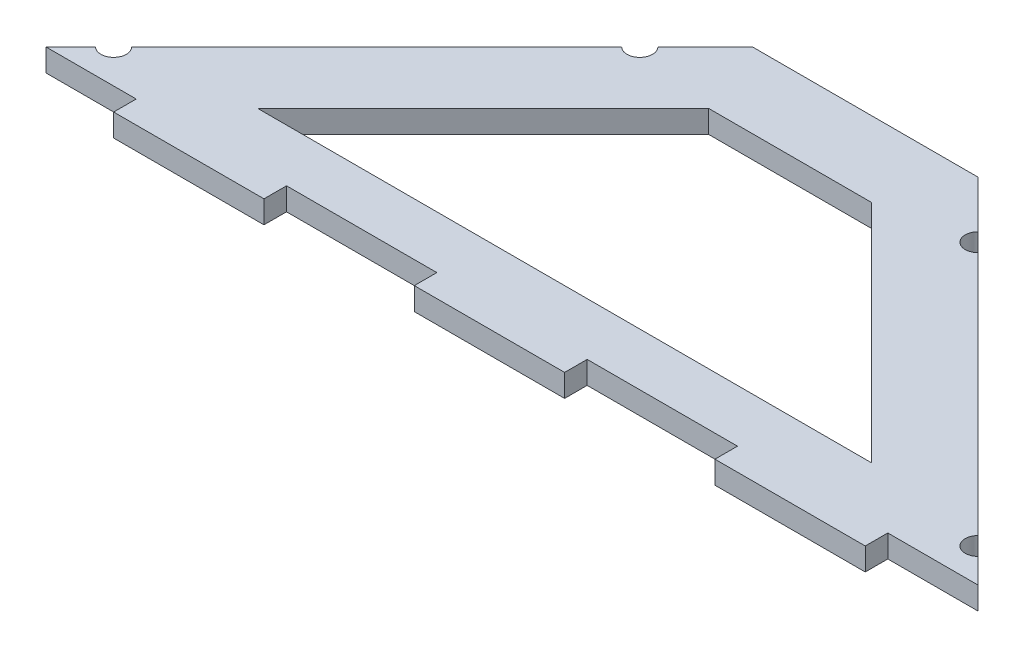
from build123d import *

# Parameters (mm, degrees)
SKETCH1_W           = 130
SKETCH1_H           = 130
SKETCH1_W_2         = 30
SKETCH1_H_2         = 30
BOSS_EXTRUDE1_DEPTH = 3
CUT_EXTRUDE1_DEPTH  = 3
CUT_EXTRUDE2_DEPTH  = 3
CUT_EXTRUDE3_DEPTH  = 10
SKETCH6_W           = 20
SKETCH6_H           = 3
CUT_EXTRUDE4_DEPTH  = 10


with BuildPart() as part:
    # Sketch1 → Boss-Extrude1 (new body)
    with BuildSketch(Plane(origin=(0, 0, 0), x_dir=(1, 0, 0), z_dir=(0, 1, 0))):
        Rectangle(SKETCH1_W, SKETCH1_H)
        Polygon((-55, 40.857864376), (-25, 10.857864376), (-25, -10.857864376), (-55, -40.857864376), align=None, mode=Mode.SUBTRACT)
        Polygon((-40.857864376, -55), (-10.857864376, -25), (10.857864376, -25), (40.857864376, -55), align=None, mode=Mode.SUBTRACT)
        Polygon((55, -40.857864376), (25, -10.857864376), (25, 10.857864376), (55, 40.857864376), align=None, mode=Mode.SUBTRACT)
        Polygon((40.857864376, 55), (10.857864376, 25), (-10.857864376, 25), (-40.857864376, 55), align=None, mode=Mode.SUBTRACT)
        Rectangle(SKETCH1_W_2, SKETCH1_H_2, mode=Mode.SUBTRACT)
    extrude(amount=BOSS_EXTRUDE1_DEPTH)

    # Sketch2 → Cut-Extrude1 (cut)
    with BuildSketch(Plane(origin=(0, 3, 0), x_dir=(1, 0, 0), z_dir=(0, 1, 0))):
        with BuildLine():
            ThreePointArc((-55.8, 57.5), (-58.702081528, 58.702081528), (-57.5, 55.8))
            Line((-57.5, 55.8), (-57.5, 57.5))
            Line((-57.5, 57.5), (-55.8, 57.5))
        make_face()
        with BuildLine():
            Line((-57.5, 57.5), (-57.5, 55.8))
            ThreePointArc((-57.5, 55.8), (-56.297918472, 56.297918472), (-55.8, 57.5))
            Line((-55.8, 57.5), (-57.5, 57.5))
        make_face()
        with BuildLine():
            Line((-57.5, -55.8), (-57.5, -57.5))
            Line((-57.5, -57.5), (-55.8, -57.5))
            ThreePointArc((-55.8, -57.5), (-56.297918472, -56.297918472), (-57.5, -55.8))
        make_face()
        with BuildLine():
            Line((-55.8, -57.5), (-57.5, -57.5))
            Line((-57.5, -57.5), (-57.5, -55.8))
            ThreePointArc((-57.5, -55.8), (-58.702081528, -58.702081528), (-55.8, -57.5))
        make_face()
        with BuildLine():
            ThreePointArc((57.5, -55.8), (56.297918472, -56.297918472), (55.8, -57.5))
            Line((55.8, -57.5), (57.5, -57.5))
            Line((57.5, -57.5), (57.5, -55.8))
        make_face()
        with BuildLine():
            Line((57.5, -57.5), (55.8, -57.5))
            ThreePointArc((55.8, -57.5), (57.5, -59.2), (59.2, -57.5))
            ThreePointArc((59.2, -57.5), (58.702081528, -56.297918472), (57.5, -55.8))
            Line((57.5, -55.8), (57.5, -57.5))
        make_face()
        with BuildLine():
            ThreePointArc((55.8, 57.5), (56.297918472, 56.297918472), (57.5, 55.8))
            Line((57.5, 55.8), (57.5, 57.5))
            Line((57.5, 57.5), (55.8, 57.5))
        make_face()
        with BuildLine():
            Line((57.5, 57.5), (57.5, 55.8))
            ThreePointArc((57.5, 55.8), (58.702081528, 56.297918472), (59.2, 57.5))
            ThreePointArc((59.2, 57.5), (57.5, 59.2), (55.8, 57.5))
            Line((55.8, 57.5), (57.5, 57.5))
        make_face()
    extrude(amount=-CUT_EXTRUDE1_DEPTH, mode=Mode.SUBTRACT)

    # Sketch3 → Cut-Extrude2 (cut)
    with BuildSketch(Plane(origin=(0, 3, 0), x_dir=(1, 0, 0), z_dir=(0, 1, 0))):
        with BuildLine():
            Line((-22.5, -20.8), (-22.5, -22.5))
            Line((-22.5, -22.5), (-20.8, -22.5))
            ThreePointArc((-20.8, -22.5), (-21.297918472, -21.297918472), (-22.5, -20.8))
        make_face()
        with BuildLine():
            Line((-20.8, -22.5), (-22.5, -22.5))
            Line((-22.5, -22.5), (-22.5, -20.8))
            ThreePointArc((-22.5, -20.8), (-23.702081528, -23.702081528), (-20.8, -22.5))
        make_face()
        with BuildLine():
            ThreePointArc((-20.8, 22.5), (-23.702081528, 23.702081528), (-22.5, 20.8))
            Line((-22.5, 20.8), (-22.5, 22.5))
            Line((-22.5, 22.5), (-20.8, 22.5))
        make_face()
        with BuildLine():
            Line((-22.5, 22.5), (-22.5, 20.8))
            ThreePointArc((-22.5, 20.8), (-21.297918472, 21.297918472), (-20.8, 22.5))
            Line((-20.8, 22.5), (-22.5, 22.5))
        make_face()
        with BuildLine():
            ThreePointArc((22.5, -20.8), (21.297918472, -21.297918472), (20.8, -22.5))
            Line((20.8, -22.5), (22.5, -22.5))
            Line((22.5, -22.5), (22.5, -20.8))
        make_face()
        with BuildLine():
            Line((22.5, -22.5), (20.8, -22.5))
            ThreePointArc((20.8, -22.5), (22.5, -24.2), (24.2, -22.5))
            ThreePointArc((24.2, -22.5), (23.702081528, -21.297918472), (22.5, -20.8))
            Line((22.5, -20.8), (22.5, -22.5))
        make_face()
        with BuildLine():
            ThreePointArc((20.8, 22.5), (21.297918472, 21.297918472), (22.5, 20.8))
            Line((22.5, 20.8), (22.5, 22.5))
            Line((22.5, 22.5), (20.8, 22.5))
        make_face()
        with BuildLine():
            Line((22.5, 22.5), (22.5, 20.8))
            ThreePointArc((22.5, 20.8), (23.702081528, 21.297918472), (24.2, 22.5))
            ThreePointArc((24.2, 22.5), (22.5, 24.2), (20.8, 22.5))
            Line((20.8, 22.5), (22.5, 22.5))
        make_face()
    extrude(amount=-CUT_EXTRUDE2_DEPTH, mode=Mode.SUBTRACT)

    # Sketch4 → Cut-Extrude3 (cut)
    # profile 1 of 14: a face of its own
    with BuildSketch(Plane(origin=(0, 3, 0), x_dir=(1, 0, 0), z_dir=(0, 1, 0))):
        with BuildLine():
            Line((-65, 65), (-65, -65))
            Line((-65, -65), (-58.702081528, -58.702081528))
            ThreePointArc((-58.702081528, -58.702081528), (-58.702081528, -56.297918472), (-56.297918472, -56.297918472))
            Line((-56.297918472, -56.297918472), (-23.702081528, -23.702081528))
            ThreePointArc((-23.702081528, -23.702081528), (-23.702081528, -21.297918472), (-21.297918472, -21.297918472))
            Line((-21.297918472, -21.297918472), (-15, -15))
            Line((-15, -15), (-15, 15))
            Line((-15, 15), (-21.297918472, 21.297918472))
            ThreePointArc((-21.297918472, 21.297918472), (-23.702081528, 21.297918472), (-23.702081528, 23.702081528))
            Line((-23.702081528, 23.702081528), (-56.297918472, 56.297918472))
            ThreePointArc((-56.297918472, 56.297918472), (-58.702081528, 56.297918472), (-58.702081528, 58.702081528))
            Line((-58.702081528, 58.702081528), (-65, 65))
        make_face()
        Polygon((-55, -40.857864376), (-55, 40.857864376), (-25, 10.857864376), (-25, -10.857864376), align=None, mode=Mode.SUBTRACT)
    # profile 2 of 14: a face of its own
    with BuildSketch(Plane(origin=(0, 3, 0), x_dir=(1, 0, 0), z_dir=(0, 1, 0))):
        Polygon((-55, 40.857864376), (-25, 10.857864376), (-25, -10.857864376), (-55, -40.857864376), align=None)
    # profile 3 of 14: a face of its own
    with BuildSketch(Plane(origin=(0, 3, 0), x_dir=(1, 0, 0), z_dir=(0, 1, 0))):
        with BuildLine():
            Line((65, 65), (-65, 65))
            Line((-65, 65), (-58.702081528, 58.702081528))
            ThreePointArc((-58.702081528, 58.702081528), (-56.849438165, 59.070595205), (-55.8, 57.5))
            ThreePointArc((-55.8, 57.5), (-55.929404795, 56.849438165), (-56.297918472, 56.297918472))
            Line((-56.297918472, 56.297918472), (-23.702081528, 23.702081528))
            ThreePointArc((-23.702081528, 23.702081528), (-21.849438165, 24.070595205), (-20.8, 22.5))
            ThreePointArc((-20.8, 22.5), (-20.929404795, 21.849438165), (-21.297918472, 21.297918472))
            Line((-21.297918472, 21.297918472), (-15, 15))
            Line((-15, 15), (15, 15))
            Line((15, 15), (21.297918472, 21.297918472))
            ThreePointArc((21.297918472, 21.297918472), (21.297918472, 23.702081528), (23.702081528, 23.702081528))
            Line((23.702081528, 23.702081528), (56.297918472, 56.297918472))
            ThreePointArc((56.297918472, 56.297918472), (56.297918472, 58.702081528), (58.702081528, 58.702081528))
            Line((58.702081528, 58.702081528), (65, 65))
        make_face()
        Polygon((40.857864376, 55), (10.857864376, 25), (-10.857864376, 25), (-40.857864376, 55), align=None, mode=Mode.SUBTRACT)
    # profile 4 of 14: a face of its own
    with BuildSketch(Plane(origin=(0, 3, 0), x_dir=(1, 0, 0), z_dir=(0, 1, 0))):
        Polygon((10.857864376, 25), (-10.857864376, 25), (-40.857864376, 55), (40.857864376, 55), align=None)
    # profile 5 of 14: a face of its own
    with BuildSketch(Plane(origin=(0, 3, 0), x_dir=(1, 0, 0), z_dir=(0, 1, 0))):
        with BuildLine():
            Line((58.702081528, -58.702081528), (65, -65))
            Line((65, -65), (65, 65))
            Line((65, 65), (58.702081528, 58.702081528))
            ThreePointArc((58.702081528, 58.702081528), (59.070595205, 58.150561835), (59.2, 57.5))
            ThreePointArc((59.2, 57.5), (58.150561835, 55.929404795), (56.297918472, 56.297918472))
            Line((56.297918472, 56.297918472), (23.702081528, 23.702081528))
            ThreePointArc((23.702081528, 23.702081528), (24.070595205, 23.150561835), (24.2, 22.5))
            ThreePointArc((24.2, 22.5), (23.150561835, 20.929404795), (21.297918472, 21.297918472))
            Line((21.297918472, 21.297918472), (15, 15))
            Line((15, 15), (15, -15))
            Line((15, -15), (21.297918472, -21.297918472))
            ThreePointArc((21.297918472, -21.297918472), (23.150561835, -20.929404795), (24.2, -22.5))
            ThreePointArc((24.2, -22.5), (24.070595205, -23.150561835), (23.702081528, -23.702081528))
            Line((23.702081528, -23.702081528), (56.297918472, -56.297918472))
            ThreePointArc((56.297918472, -56.297918472), (58.150561835, -55.929404795), (59.2, -57.5))
            ThreePointArc((59.2, -57.5), (59.070595205, -58.150561835), (58.702081528, -58.702081528))
        make_face()
        Polygon((55, -40.857864376), (25, -10.857864376), (25, 10.857864376), (55, 40.857864376), align=None, mode=Mode.SUBTRACT)
    # profile 6 of 14: a face of its own
    with BuildSketch(Plane(origin=(0, 3, 0), x_dir=(1, 0, 0), z_dir=(0, 1, 0))):
        Polygon((25, -10.857864376), (25, 10.857864376), (55, 40.857864376), (55, -40.857864376), align=None)
    # profile 7 of 14: a face of its own
    with BuildSketch(Plane(origin=(0, 3, 0), x_dir=(1, 0, 0), z_dir=(0, 1, 0))):
        with BuildLine():
            ThreePointArc((-56.297918472, -56.297918472), (-58.702081528, -56.297918472), (-58.702081528, -58.702081528))
            Line((-58.702081528, -58.702081528), (-56.297918472, -56.297918472))
        make_face()
    # profile 8 of 14: a face of its own
    with BuildSketch(Plane(origin=(0, 3, 0), x_dir=(1, 0, 0), z_dir=(0, 1, 0))):
        with BuildLine():
            Line((-56.297918472, -56.297918472), (-58.702081528, -58.702081528))
            ThreePointArc((-58.702081528, -58.702081528), (-56.849438165, -59.070595205), (-55.8, -57.5))
            ThreePointArc((-55.8, -57.5), (-55.929404795, -56.849438165), (-56.297918472, -56.297918472))
        make_face()
    # profile 9 of 14: a face of its own
    with BuildSketch(Plane(origin=(0, 3, 0), x_dir=(1, 0, 0), z_dir=(0, 1, 0))):
        with BuildLine():
            ThreePointArc((-21.297918472, -21.297918472), (-23.702081528, -21.297918472), (-23.702081528, -23.702081528))
            Line((-23.702081528, -23.702081528), (-21.297918472, -21.297918472))
        make_face()
    # profile 10 of 14: a face of its own
    with BuildSketch(Plane(origin=(0, 3, 0), x_dir=(1, 0, 0), z_dir=(0, 1, 0))):
        with BuildLine():
            Line((-21.297918472, -21.297918472), (-23.702081528, -23.702081528))
            ThreePointArc((-23.702081528, -23.702081528), (-21.849438165, -24.070595205), (-20.8, -22.5))
            ThreePointArc((-20.8, -22.5), (-20.929404795, -21.849438165), (-21.297918472, -21.297918472))
        make_face()
    # profile 11 of 14: a face of its own
    with BuildSketch(Plane(origin=(0, 3, 0), x_dir=(1, 0, 0), z_dir=(0, 1, 0))):
        with BuildLine():
            ThreePointArc((21.297918472, -21.297918472), (21.297918472, -23.702081528), (23.702081528, -23.702081528))
            Line((23.702081528, -23.702081528), (21.297918472, -21.297918472))
        make_face()
    # profile 12 of 14: a face of its own
    with BuildSketch(Plane(origin=(0, 3, 0), x_dir=(1, 0, 0), z_dir=(0, 1, 0))):
        with BuildLine():
            Line((21.297918472, -21.297918472), (23.702081528, -23.702081528))
            ThreePointArc((23.702081528, -23.702081528), (24.070595205, -23.150561835), (24.2, -22.5))
            ThreePointArc((24.2, -22.5), (23.150561835, -20.929404795), (21.297918472, -21.297918472))
        make_face()
    # profile 13 of 14: a face of its own
    with BuildSketch(Plane(origin=(0, 3, 0), x_dir=(1, 0, 0), z_dir=(0, 1, 0))):
        with BuildLine():
            ThreePointArc((56.297918472, -56.297918472), (56.297918472, -58.702081528), (58.702081528, -58.702081528))
            Line((58.702081528, -58.702081528), (56.297918472, -56.297918472))
        make_face()
    # profile 14 of 14: a face of its own
    with BuildSketch(Plane(origin=(0, 3, 0), x_dir=(1, 0, 0), z_dir=(0, 1, 0))):
        with BuildLine():
            Line((56.297918472, -56.297918472), (58.702081528, -58.702081528))
            ThreePointArc((58.702081528, -58.702081528), (59.070595205, -58.150561835), (59.2, -57.5))
            ThreePointArc((59.2, -57.5), (58.150561835, -55.929404795), (56.297918472, -56.297918472))
        make_face()
    extrude(amount=-CUT_EXTRUDE3_DEPTH, mode=Mode.SUBTRACT)

    # Sketch6 → Cut-Extrude4 (cut)
    with BuildSketch(Plane(origin=(0, 3, 0), x_dir=(1, 0, 0), z_dir=(0, 1, 0))):
        Polygon((-62, -62), (-65, -65), (-50, -65), (-50, -62), align=None)
        with Locations((-20, -63.5)):
            Rectangle(SKETCH6_W, SKETCH6_H)
        with Locations((20, -63.5)):
            Rectangle(SKETCH6_W, SKETCH6_H)
        Polygon((50, -62), (50, -65), (65, -65), (62, -62), align=None)
    extrude(amount=-CUT_EXTRUDE4_DEPTH, mode=Mode.SUBTRACT)


solid = part.part
